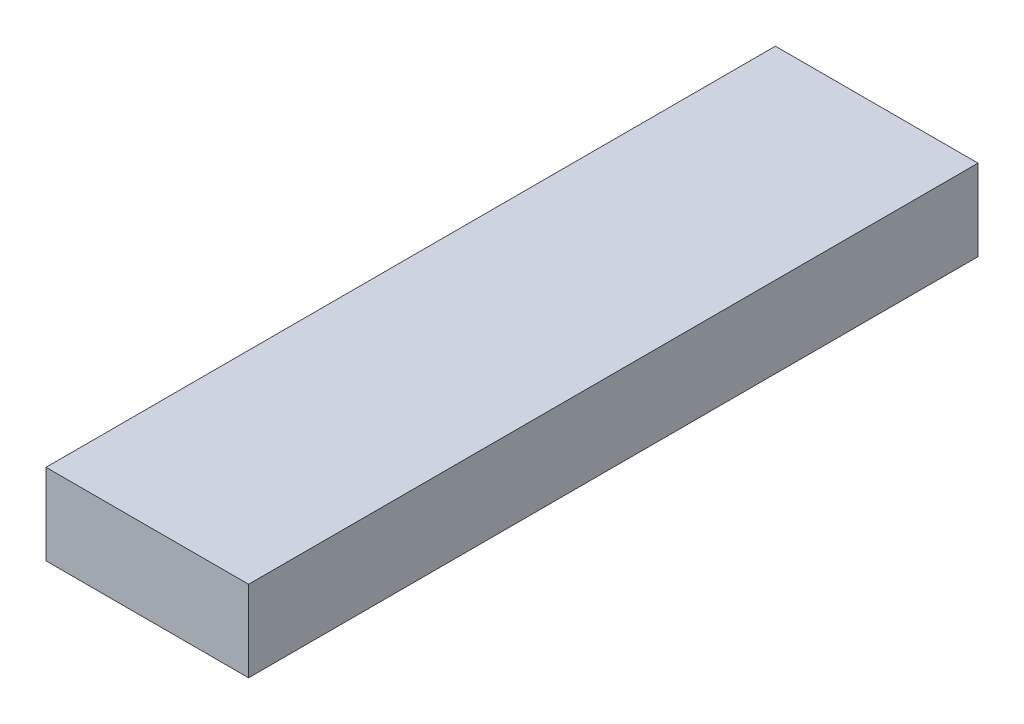
from build123d import *

# Parameters (mm, degrees)
SKETCH1_W           = 50
SKETCH1_H           = 180
BOSS_EXTRUDE1_DEPTH = 20


with BuildPart() as part:
    # Sketch1 → Boss-Extrude1 (new body)
    with BuildSketch(Plane(origin=(0, 0, 0), x_dir=(1, 0, 0), z_dir=(0, 1, 0))):
        Rectangle(SKETCH1_W, SKETCH1_H)
    extrude(amount=BOSS_EXTRUDE1_DEPTH)


solid = part.part
